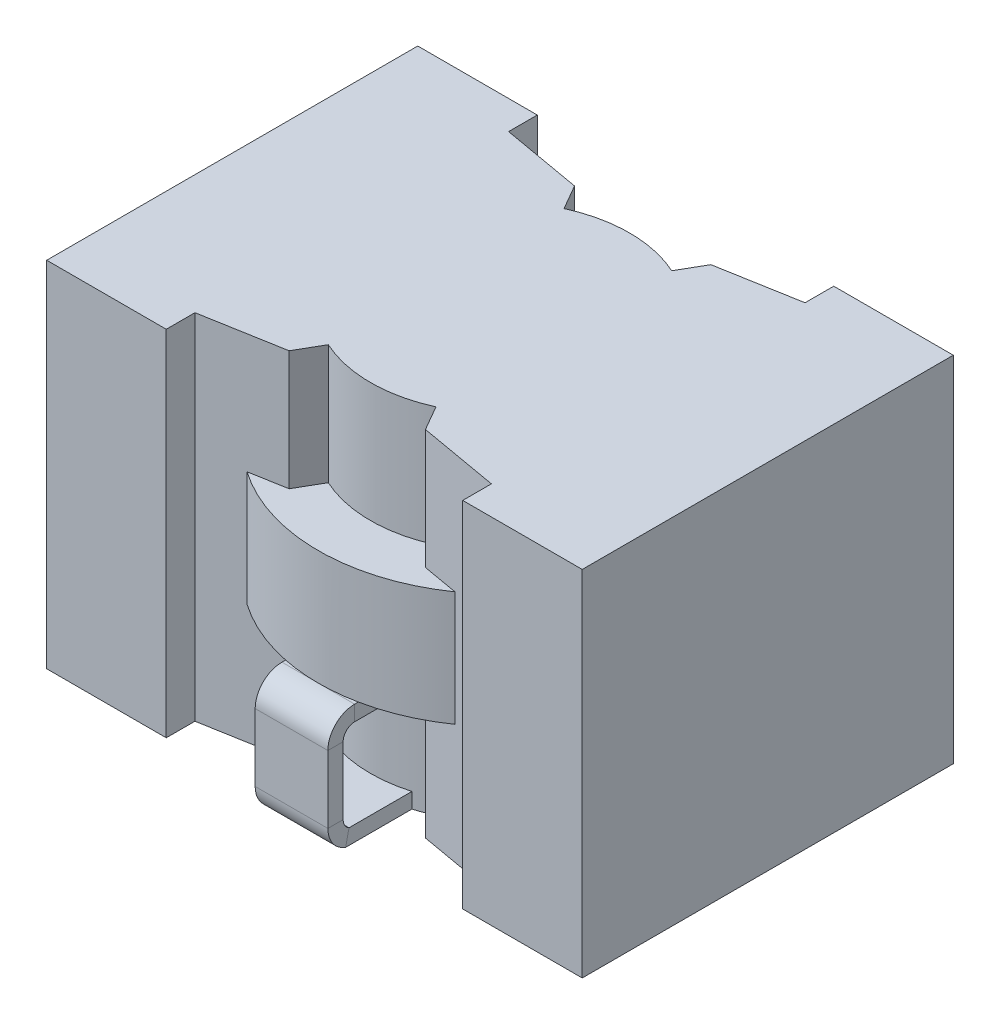
from build123d import *

# Parameters (mm, degrees)
SKETCH1_W           = 28
SKETCH1_H           = 19.4
BOSS_EXTRUDE1_DEPTH = 18.5
CUT_EXTRUDE1_REACH  = 40.764
SKETCH3_R           = 9.5
BOSS_EXTRUDE2_DEPTH = 3
SKETCH4_W           = 3.8
SKETCH4_H           = 0.8
SKETCH7_W           = 3.8
SKETCH7_H           = 0.8
SKETCH9_W           = 3.8
SKETCH9_H           = 0.8


with BuildPart() as part:
    # Sketch1 → Boss-Extrude1 (new body)
    with BuildSketch(Plane(origin=(0, 0, 0), x_dir=(1, 0, 0), z_dir=(0, 1, 0))):
        with Locations((14, 9.7)):
            Rectangle(SKETCH1_W, SKETCH1_H)
    extrude(amount=BOSS_EXTRUDE1_DEPTH)

    # Sketch2 → Cut-Extrude1 (cut, up to next)
    with BuildSketch(Plane(origin=(0, 18.5, 0), x_dir=(1, 0, 0), z_dir=(0, 1, 0)), mode=Mode.PRIVATE) as cut_extrude1_sk1:
        with BuildLine():
            Line((21.75, 19.4), (6.25, 19.4))
            Line((6.25, 19.4), (6.25, 17.9))
            Line((6.25, 17.9), (10.43543295, 17.161995245))
            Line((10.43543295, 17.161995245), (11.18543295, 15.862957139))
            ThreePointArc((11.18543295, 15.862957139), (14, 16.475236407), (16.81456705, 15.862957139))
            Line((16.81456705, 15.862957139), (17.56456705, 17.161995245))
            Line((17.56456705, 17.161995245), (21.75, 17.9))
            Line((21.75, 17.9), (21.75, 19.4))
        make_face()
    cut_extrude1_tool1 = extrude(cut_extrude1_sk1.sketch, amount=-CUT_EXTRUDE1_REACH, mode=Mode.PRIVATE) & part.part
    cut_extrude1 = cut_extrude1_tool1.solids().sort_by_distance((14, 18.5, -18.102392))[0]
    add(cut_extrude1, mode=Mode.SUBTRACT)

    # Mirror1: Cut-Extrude1 across plane
    add(cut_extrude1.mirror(Plane.XY.offset(-9.7)), mode=Mode.SUBTRACT)

    # Sketch3 → Boss-Extrude2 (add, symmetric)
    with BuildSketch(Plane(origin=(0, 9.25, 0), x_dir=(1, 0, 0), z_dir=(0, 1, 0))):
        with Locations((14, 9.7)):
            Circle(SKETCH3_R)
    extrude(amount=BOSS_EXTRUDE2_DEPTH, both=True)

    # Sweep1: sweep along a path in Sketch6
    with BuildLine(Plane.ZY.offset(-18.71456705)) as sweep1_path:
        Line((-9.7, 12.65), (-20.9, 12.65))
        ThreePointArc((-20.9, 12.65), (-21.607106781, 12.357106781), (-21.9, 11.65))
        Line((-21.9, 11.65), (-21.9, 1.4))
        ThreePointArc((-21.9, 1.4), (-22.192893219, 0.692893219), (-22.9, 0.4))
        Line((-22.9, 0.4), (-26.1, 0.4))
    # Sketch4 → Sweep1 (sweep)
    with BuildSketch(Plane.XY.offset(-9.7)):
        with Locations((18.71456705, 12.65)):
            Rectangle(SKETCH4_W, SKETCH4_H)
    sweep(path=sweep1_path.line)

    # Sweep3: sweep along a path in Sketch12
    with BuildLine(Plane.ZY.offset(-14)) as sweep3_path:
        Line((-9.7, 5.85), (-0.2, 5.85))
        ThreePointArc((-0.2, 5.85), (0.507106781, 5.557106781), (0.8, 4.85))
        Line((0.8, 4.85), (0.8, 1.322538328))
        ThreePointArc((0.8, 1.322538328), (0.632437827, 0.768419871), (0.185905473, 0.4))
        Line((0.185905473, 0.4), (-9.7, 0.4))
    # Sketch9 → Sweep3 (sweep)
    with BuildSketch(Plane.XY.offset(-9.7)):
        with Locations((14, 5.85)):
            Rectangle(SKETCH9_W, SKETCH9_H)
    sweep(path=sweep3_path.line, transition=Transition.RIGHT)


with BuildPart() as body_2:
    # Sweep2: sweep along a path in Sketch8
    with BuildLine(Plane.ZY.offset(-9.28543295)) as sweep2_path:
        Line((-9.7, 5.85), (-20.9, 5.85))
        ThreePointArc((-20.9, 5.85), (-21.607106781, 5.557106781), (-21.9, 4.85))
        Line((-21.9, 4.85), (-21.9, 1.4))
        ThreePointArc((-21.9, 1.4), (-22.192893219, 0.692893219), (-22.9, 0.4))
        Line((-22.9, 0.4), (-26.1, 0.4))
    # Sketch7 → Sweep2 (sweep)
    with BuildSketch(Plane.XY.offset(-9.7)):
        with Locations((9.28543295, 5.85)):
            Rectangle(SKETCH7_W, SKETCH7_H)
    sweep(path=sweep2_path.line)


solid = Compound([part.part, body_2.part])
